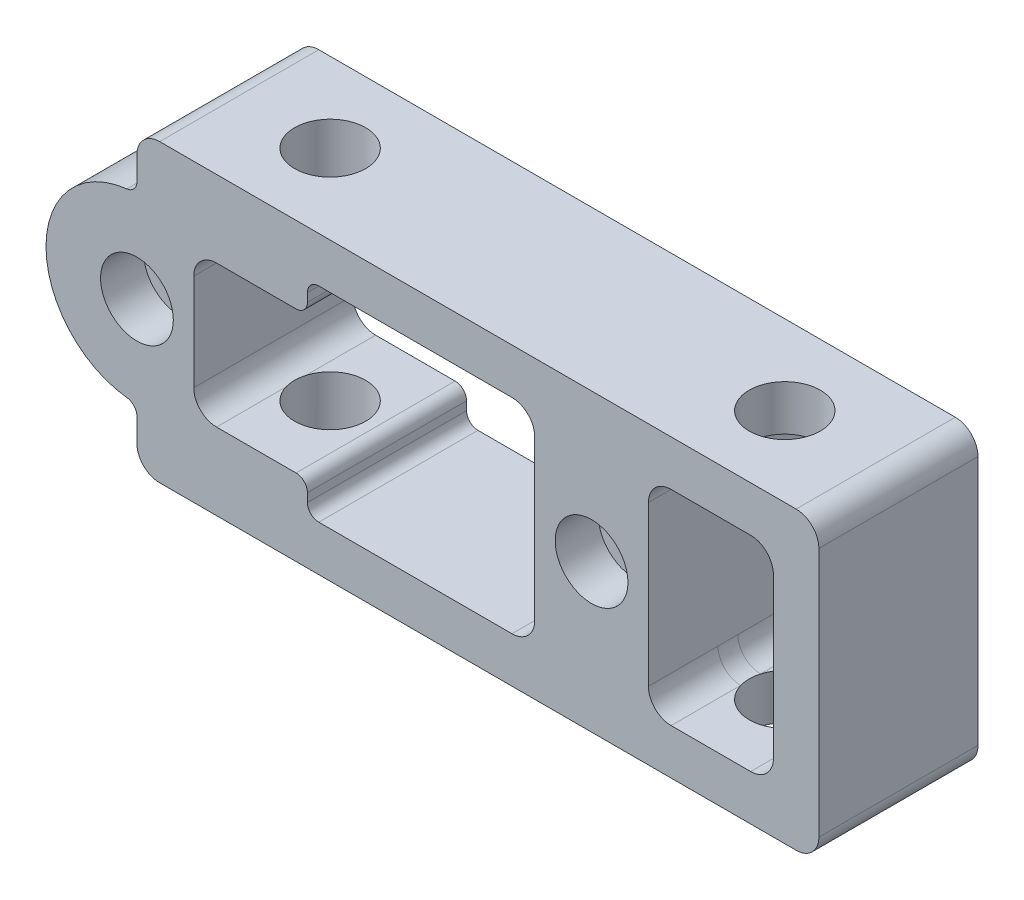
from build123d import *

# Parameters (mm, degrees)
SKETCH1_W           = 101.6
SKETCH1_H           = 17.78
SKETCH1_R           = 3.96875
BOSS_EXTRUDE1_DEPTH = 33.02
SKETCH2_R           = 2.4892
CUT_EXTRUDE1_DEPTH  = 17.78
SKETCH3_R           = 4.064
CUT_EXTRUDE2_DEPTH  = 4.826
CUT_EXTRUDE3_DEPTH  = 109.300548475
FILLET1_R           = 2.54
SKETCH6_W           = 13.97
SKETCH6_H           = 22.86
SKETCH6_W_2         = 10.94852006
SKETCH6_H_2         = 22.718450652
CUT_EXTRUDE4_DEPTH  = 106.921350067
FILLET2_R           = 2.54
FILLET3_R           = 1.27


with BuildPart() as part:
    # Sketch1 → Boss-Extrude1 (new body)
    with BuildSketch(Plane(origin=(0, 0, 0), x_dir=(1, 0, 0), z_dir=(0, 1, 0))):
        with Locations((50.8, 8.89)):
            Rectangle(SKETCH1_W, SKETCH1_H)
        with Locations(Location((76.2, 8.89, 0), (0, 0, 270))):
            Circle(SKETCH1_R, mode=Mode.SUBTRACT)
        with Locations(Location((25.4, 8.89, 0), (0, 0, 270))):
            Circle(SKETCH1_R, mode=Mode.SUBTRACT)
    extrude(amount=-BOSS_EXTRUDE1_DEPTH)

    # Sketch2 → Cut-Extrude1 (cut)
    with BuildSketch(Plane.XY):
        with Locations((63.5, -16.51)):
            Circle(SKETCH2_R)
        with Locations((12.7, -16.51)):
            Circle(SKETCH2_R)
    extrude(amount=-CUT_EXTRUDE1_DEPTH, mode=Mode.SUBTRACT)

    # Sketch3 → Cut-Extrude2 (cut)
    with BuildSketch(Plane.XY):
        with Locations((63.5, -16.51)):
            Circle(SKETCH3_R)
        with Locations((12.7, -16.51)):
            Circle(SKETCH3_R)
    extrude(amount=-CUT_EXTRUDE2_DEPTH, mode=Mode.SUBTRACT)

    # Sketch5 → Cut-Extrude3 (cut, through all)
    with BuildSketch(Plane.XY):
        with BuildLine():
            Line((12.7, -5.150774674), (12.7, 0))
            Line((12.7, 0), (0, 0))
            Line((0, 0), (0, -33.02))
            Line((0, -33.02), (12.7, -33.02))
            Line((12.7, -33.02), (12.7, -27.869225326))
            ThreePointArc((12.7, -27.869225326), (12.37660211, -27.022558659), (11.571111111, -26.607089178))
            ThreePointArc((11.571111111, -26.607089178), (2.54, -16.51), (11.571111111, -6.412910822))
            ThreePointArc((11.571111111, -6.412910822), (12.37660211, -5.997441341), (12.7, -5.150774674))
        make_face()
        with BuildLine():
            Line((88.9, -5.150774674), (88.9, 0))
            Line((88.9, 0), (101.6, 0))
            Line((101.6, 0), (101.6, -33.02))
            Line((101.6, -33.02), (88.9, -33.02))
            Line((88.9, -33.02), (88.9, -27.869225326))
            ThreePointArc((88.9, -27.869225326), (89.22339789, -27.022558659), (90.028888889, -26.607089178))
            ThreePointArc((90.028888889, -26.607089178), (99.06, -16.51), (90.028888889, -6.412910822))
            ThreePointArc((90.028888889, -6.412910822), (89.22339789, -5.997441341), (88.9, -5.150774674))
        make_face()
    extrude(amount=-CUT_EXTRUDE3_DEPTH, mode=Mode.SUBTRACT)

    # Fillet1
    fillet1_edges = [part.edges().sort_by_distance(p)[0] for p in [
        (12.7, -33.02, -8.89),
        (12.7, 0, -8.89),
        (88.9, 0, -8.89),
        (88.9, -33.02, -8.89),
    ]]
    fillet(fillet1_edges, radius=FILLET1_R)

    # Sketch6 → Cut-Extrude4 (cut, through all)
    with BuildSketch(Plane.XY):
        with BuildLine():
            Line((19.05, -21.9075), (19.05, -11.1125))
            ThreePointArc((19.05, -11.1125), (19.793948776, -9.316448776), (21.59, -8.5725))
            Line((21.59, -8.5725), (31.75, -8.5725))
            Line((31.75, -8.5725), (31.75, -5.08))
            Line((31.75, -5.08), (54.61, -5.08))
            ThreePointArc((54.61, -5.08), (56.406051224, -5.823948776), (57.15, -7.62))
            Line((57.15, -7.62), (57.15, -25.4))
            ThreePointArc((57.15, -25.4), (56.406051224, -27.196051224), (54.61, -27.94))
            Line((54.61, -27.94), (31.75, -27.94))
            Line((31.75, -27.94), (31.75, -24.4475))
            Line((31.75, -24.4475), (21.59, -24.4475))
            ThreePointArc((21.59, -24.4475), (19.793948776, -23.703551224), (19.05, -21.9075))
        make_face()
        with Locations((76.835, -16.51)):
            Rectangle(SKETCH6_W, SKETCH6_H)
        with Locations((94.37426003, -16.51)):
            Rectangle(SKETCH6_W_2, SKETCH6_H_2)
    extrude(amount=-CUT_EXTRUDE4_DEPTH, mode=Mode.SUBTRACT)

    # Fillet2
    fillet2_edges = [part.edges().sort_by_distance(p)[0] for p in [
        (69.85, -5.08, -8.89),
        (83.82, -27.94, -8.89),
        (83.82, -5.08, -8.89),
        (69.85, -27.94, -8.89),
    ]]
    fillet(fillet2_edges, radius=FILLET2_R)

    # Fillet3
    fillet3_edges = [part.edges().sort_by_distance(p)[0] for p in [
        (31.75, -24.4475, -8.89),
        (31.75, -8.5725, -8.89),
        (31.75, -5.08, -8.89),
        (31.75, -27.94, -8.89),
    ]]
    fillet(fillet3_edges, radius=FILLET3_R)


solid = part.part
